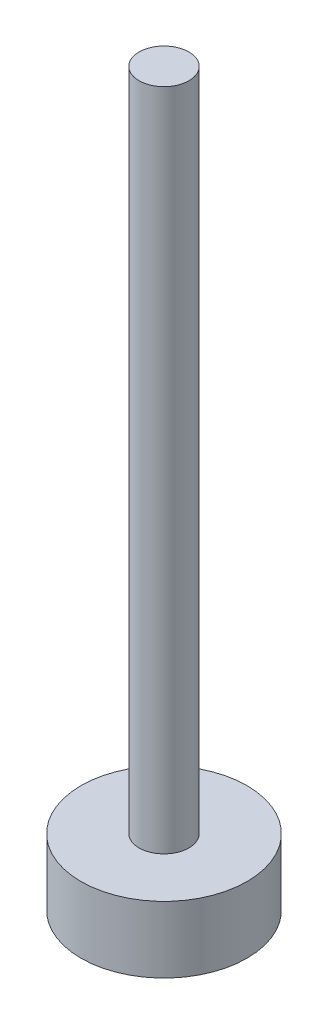
from build123d import *

# Parameters (mm, degrees)
SKETCH2_R           = 25
BOSS_EXTRUDE3_DEPTH = 20
SKETCH3_R           = 7.5
BOSS_EXTRUDE4_DEPTH = 200


with BuildPart() as part:
    # Sketch2 → Boss-Extrude3 (new body)
    with BuildSketch(Plane(origin=(0, 0, 0), x_dir=(1, 0, 0), z_dir=(0, 1, 0))):
        with Locations(Location((0, 0, 0), (0, 0, 270))):
            Circle(SKETCH2_R)
    extrude(amount=BOSS_EXTRUDE3_DEPTH)

    # Sketch3 → Boss-Extrude4 (add)
    with BuildSketch(Plane(origin=(0, 20, 0), x_dir=(1, 0, 0), z_dir=(0, 1, 0))):
        with Locations(Location((0, 0, 0), (0, 0, 270))):
            Circle(SKETCH3_R)
    extrude(amount=BOSS_EXTRUDE4_DEPTH)


solid = part.part
